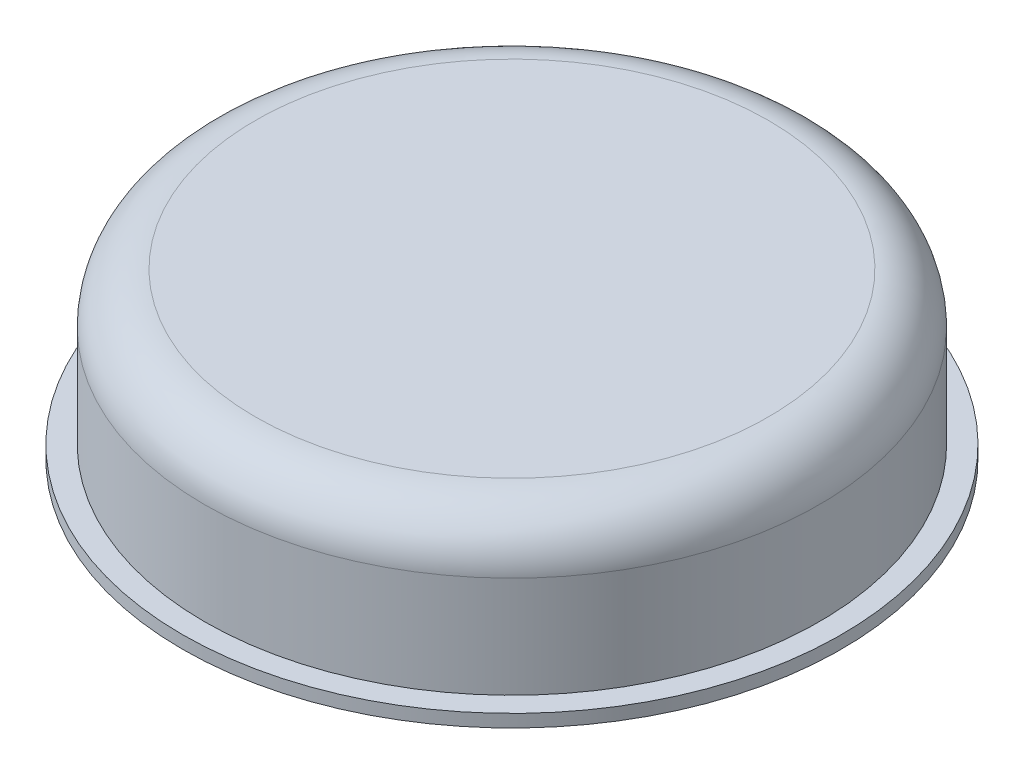
from build123d import *

# Parameters (mm, degrees)
SKETCH1_R           = 26
BOSS_EXTRUDE1_DEPTH = 1
SKETCH2_R           = 24.25
BOSS_EXTRUDE2_DEPTH = 12
FILLET1_R           = 4


with BuildPart() as part:
    # Sketch1 → Boss-Extrude1 (new body)
    with BuildSketch(Plane(origin=(0, 0, 0), x_dir=(1, 0, 0), z_dir=(0, 1, 0))):
        with Locations(Location((0, 0, 0), (0, 0, 270))):
            Circle(SKETCH1_R)
    extrude(amount=BOSS_EXTRUDE1_DEPTH)

    # Sketch2 → Boss-Extrude2 (add)
    with BuildSketch(Plane(origin=(0, 1, 0), x_dir=(1, 0, 0), z_dir=(0, 1, 0))):
        with Locations(Location((0, 0, 0), (0, 0, 270))):
            Circle(SKETCH2_R)
    extrude(amount=BOSS_EXTRUDE2_DEPTH)

    # Fillet1
    fillet1_edges = [part.edges().sort_by_distance(p)[0] for p in [
        (0, 13, -24.25),
    ]]
    fillet(fillet1_edges, radius=FILLET1_R)


solid = part.part
